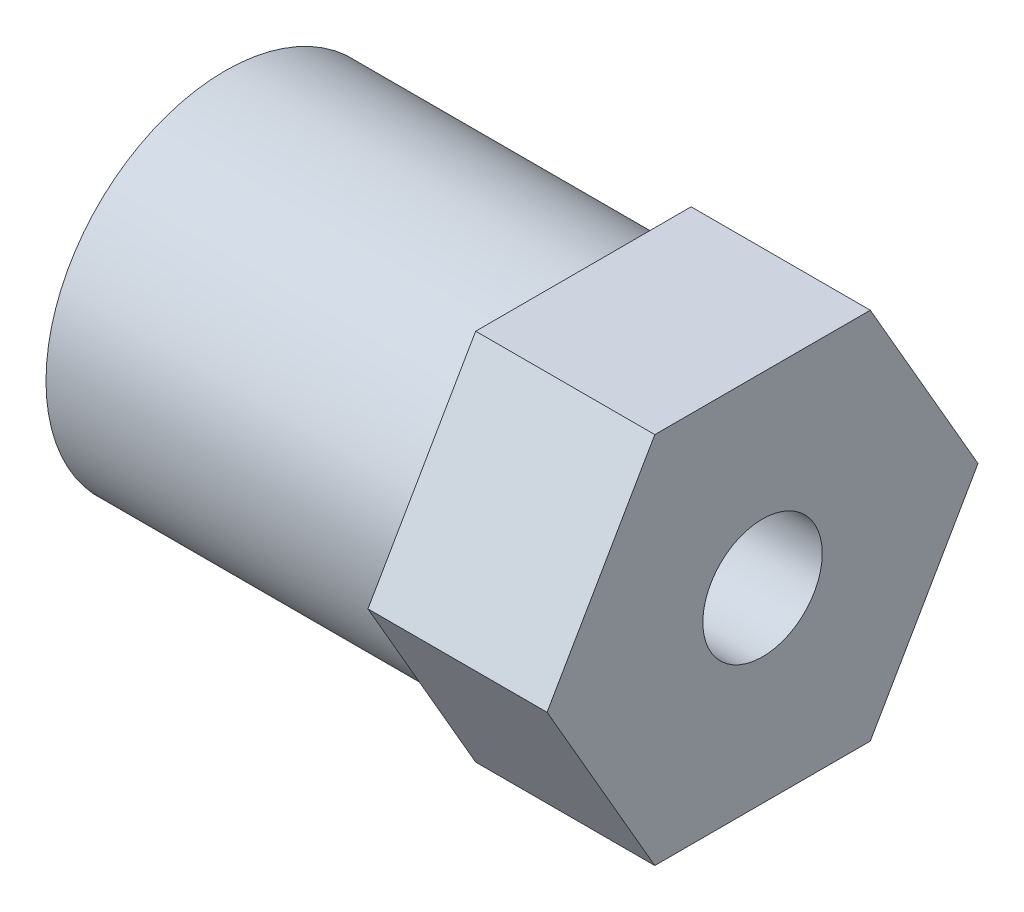
from build123d import *

# Parameters (mm, degrees)
BOSS_EXTRUDE1_DEPTH = 6
SKETCH2_R           = 6
BOSS_EXTRUDE2_DEPTH = 12
SKETCH3_R           = 3
CUT_EXTRUDE1_DEPTH  = 12
SKETCH4_R           = 2
CUT_EXTRUDE2_DEPTH  = 21.375127811


with BuildPart() as part:
    # Sketch1 → Boss-Extrude1 (new body)
    with BuildSketch(Plane(origin=(0, 0, 0), x_dir=(0, 0, -1), z_dir=(1, 0, 0))):
        Polygon((7.216878365, 0), (3.608439182, 6.25), (-3.608439182, 6.25), (-7.216878365, 0), (-3.608439182, -6.25), (3.608439182, -6.25), align=None)
    extrude(amount=BOSS_EXTRUDE1_DEPTH)

    # Sketch2 → Boss-Extrude2 (add)
    with BuildSketch(Plane.ZY):
        with Locations(Location((0, 0, 0), (0, 0, 180))):
            Circle(SKETCH2_R)
    extrude(amount=BOSS_EXTRUDE2_DEPTH)

    # Sketch3 → Cut-Extrude1 (cut)
    with BuildSketch(Plane.ZY.offset(12)):
        Circle(SKETCH3_R)
    extrude(amount=-CUT_EXTRUDE1_DEPTH, mode=Mode.SUBTRACT)

    # Sketch4 → Cut-Extrude2 (cut, through all)
    with BuildSketch(Plane(origin=(6, 0, 0), x_dir=(0, 0, -1), z_dir=(1, 0, 0))):
        Circle(SKETCH4_R)
    extrude(amount=-CUT_EXTRUDE2_DEPTH, mode=Mode.SUBTRACT)


solid = part.part
